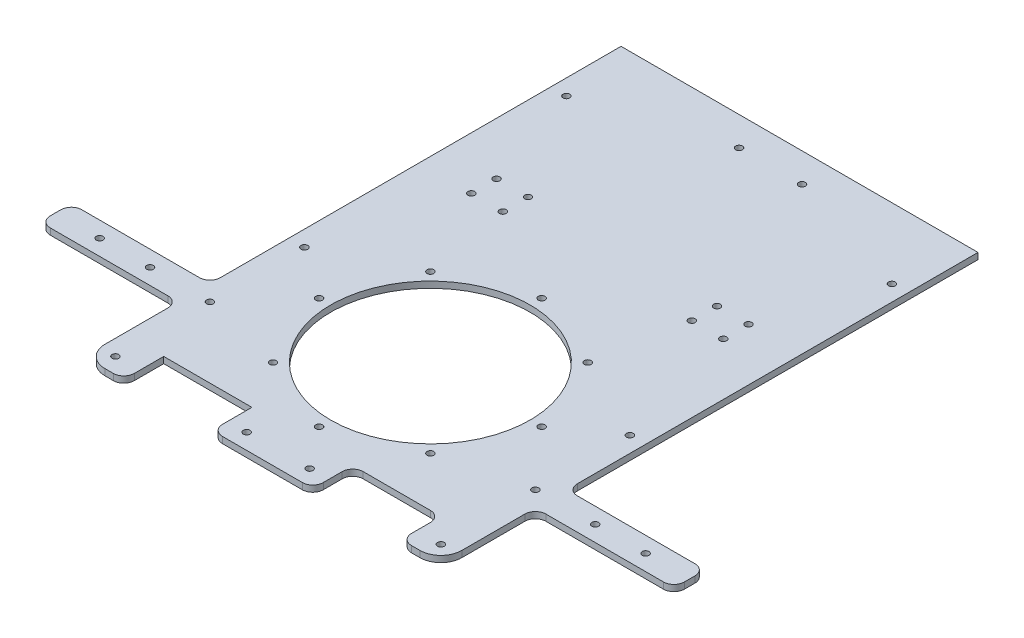
from build123d import *

# Parameters (mm, degrees)
BOSS_EXTRUDE1_DEPTH = 3
FILLET1_R           = 200
FILLET2_R           = 10
CUT_EXTRUDE2_DEPTH  = 429.345808882
SKETCH3_W           = 42
SKETCH3_H           = 23
SKETCH3_H_2         = 19
CUT_EXTRUDE3_DEPTH  = 429.345808882
SKETCH4_R           = 1.6
CUT_EXTRUDE5_DEPTH  = 429.345808882
SKETCH5_R           = 1.6
CUT_EXTRUDE6_DEPTH  = 429.345808882
SKETCH6_W           = 66
SKETCH6_H           = 15
SKETCH6_R           = 1.6
BOSS_EXTRUDE2_DEPTH = 3
FILLET3_R           = 5
SKETCH7_R           = 1.6
CUT_EXTRUDE7_DEPTH  = 435.224748243
SKETCH9_R           = 1.6
CUT_EXTRUDE8_DEPTH  = 435.224748243
SKETCH10_W          = 280
SKETCH10_H          = 108.680633212
CUT_EXTRUDE9_DEPTH  = 10


with BuildPart() as part:
    # Sketch1 → Boss-Extrude1 (new body)
    with BuildSketch(Plane(origin=(0, 0, 0), x_dir=(1, 0, 0), z_dir=(0, 1, 0))):
        Polygon((0, 0), (170, 0), (170, 300), (225, 300), (225, 367.51288694), (85, 330), (-55, 367.51288694), (-55, 300), (0, 300), align=None)
    extrude(amount=BOSS_EXTRUDE1_DEPTH)

    # Fillet1
    fillet1_edges = [part.edges().sort_by_distance(p)[0] for p in [
        (85, 1.5, -330),
    ]]
    fillet(fillet1_edges, radius=FILLET1_R)

    # Fillet2
    fillet2_edges = [part.edges().sort_by_distance(p)[0] for p in [
        (0, 1.5, -300),
        (-55, 1.5, -300),
        (-55, 1.5, -367.51288694),
        (225, 1.5, -367.51288694),
        (225, 1.5, -300),
        (170, 1.5, -300),
        (170, 1.5, 0),
        (0, 1.5, 0),
    ]]
    fillet(fillet2_edges, radius=FILLET2_R)

    # Sketch2 → Cut-Extrude2 (cut, through all)
    with BuildSketch(Plane(origin=(0, 3, 0), x_dir=(1, 0, 0), z_dir=(0, 1, 0))):
        with BuildLine():
            ThreePointArc((132.5, 80), (118.587572106, 113.587572106), (85, 127.5))
            Line((85, 127.5), (85, 32.5))
            ThreePointArc((85, 32.5), (118.587572106, 46.412427894), (132.5, 80))
        make_face()
        with BuildLine():
            Line((85, 32.5), (85, 127.5))
            ThreePointArc((85, 127.5), (37.5, 80), (85, 32.5))
        make_face()
    extrude(amount=-CUT_EXTRUDE2_DEPTH, mode=Mode.SUBTRACT)

    # Sketch3 → Cut-Extrude3 (cut, through all)
    with BuildSketch(Plane(origin=(0, 3, 0), x_dir=(1, 0, 0), z_dir=(0, 1, 0))):
        with Locations((40, 267.3)):
            Rectangle(SKETCH3_W, SKETCH3_H)
        with Locations((130, 267.3)):
            Rectangle(SKETCH3_W, SKETCH3_H)
        with Locations((40, 9.5)):
            Rectangle(SKETCH3_W, SKETCH3_H_2)
        with Locations((130, 9.5)):
            Rectangle(SKETCH3_W, SKETCH3_H_2)
    extrude(amount=-CUT_EXTRUDE3_DEPTH, mode=Mode.SUBTRACT)

    # Sketch4 → Cut-Extrude5 (cut, through all)
    with BuildSketch(Plane(origin=(0, 3, 0), x_dir=(1, 0, 0), z_dir=(0, 1, 0))):
        with Locations(Location((85, 133, 0), (0, 0, 270))):
            Circle(SKETCH4_R)
        with Locations(Location((122.476659403, 117.476659403, 0), (0, 0, 270))):
            Circle(SKETCH4_R)
        with Locations(Location((138, 80, 0), (0, 0, 270))):
            Circle(SKETCH4_R)
        with Locations(Location((122.476659403, 42.523340597, 0), (0, 0, 270))):
            Circle(SKETCH4_R)
        with Locations(Location((85, 27, 0), (0, 0, 270))):
            Circle(SKETCH4_R)
        with Locations(Location((47.523340597, 42.523340597, 0), (0, 0, 270))):
            Circle(SKETCH4_R)
        with Locations(Location((32, 80, 0), (0, 0, 270))):
            Circle(SKETCH4_R)
        with Locations(Location((47.523340597, 117.476659403, 0), (0, 0, 270))):
            Circle(SKETCH4_R)
    extrude(amount=-CUT_EXTRUDE5_DEPTH, mode=Mode.SUBTRACT)

    # Sketch5 → Cut-Extrude6 (cut, through all)
    with BuildSketch(Plane(origin=(0, 3, 0), x_dir=(1, 0, 0), z_dir=(0, 1, 0))):
        with Locations(Location((7.5, 312, 0), (0, 0, 270))):
            Circle(SKETCH5_R)
        with Locations(Location((7.5, 267.3, 0), (0, 0, 270))):
            Circle(SKETCH5_R)
        with Locations(Location((7.5, 222.3, 0), (0, 0, 270))):
            Circle(SKETCH5_R)
        with Locations(Location((7.5, 97.5, 0), (0, 0, 270))):
            Circle(SKETCH5_R)
        with Locations(Location((7.5, 7.5, 0), (0, 0, 270))):
            Circle(SKETCH5_R)
        with Locations(Location((7.5, 52.5, 0), (0, 0, 270))):
            Circle(SKETCH5_R)
        with Locations(Location((70, 7.5, 0), (0, 0, 270))):
            Circle(SKETCH5_R)
        with Locations(Location((100, 7.5, 0), (0, 0, 270))):
            Circle(SKETCH5_R)
        with Locations(Location((162.5, 7.5, 0), (0, 0, 270))):
            Circle(SKETCH5_R)
        with Locations(Location((162.5, 52.5, 0), (0, 0, 270))):
            Circle(SKETCH5_R)
        with Locations(Location((162.5, 97.5, 0), (0, 0, 270))):
            Circle(SKETCH5_R)
        with Locations(Location((162.5, 222.3, 0), (0, 0, 270))):
            Circle(SKETCH5_R)
        with Locations(Location((162.5, 267.3, 0), (0, 0, 270))):
            Circle(SKETCH5_R)
        with Locations(Location((162.5, 312, 0), (0, 0, 270))):
            Circle(SKETCH5_R)
        with Locations(Location((162.5, 342.75495241, 0), (0, 0, 270))):
            Circle(SKETCH5_R)
        with Locations(Location((109.337835254, 328.510193298, 0), (0, 0, 270))):
            Circle(SKETCH5_R)
        with Locations(Location((60.662164746, 328.510193298, 0), (0, 0, 270))):
            Circle(SKETCH5_R)
        with Locations(Location((7.5, 342.75495241, 0), (0, 0, 270))):
            Circle(SKETCH5_R)
        with Locations(Location((70, 267.5, 0), (0, 0, 270))):
            Circle(SKETCH5_R)
        with Locations(Location((100, 267.5, 0), (0, 0, 270))):
            Circle(SKETCH5_R)
    extrude(amount=-CUT_EXTRUDE6_DEPTH, mode=Mode.SUBTRACT)

    # Sketch6 → Boss-Extrude2 (add)
    # profile 1 of 2: a face of its own
    with BuildSketch(Plane.XZ):
        with Locations((-33, -52.5)):
            Rectangle(SKETCH6_W, SKETCH6_H)
        with Locations(Location((-45, -52.5, 0), (0, 0, 270))):
            Circle(SKETCH6_R, mode=Mode.SUBTRACT)
        with Locations(Location((-21, -52.5, 0), (0, 0, 270))):
            Circle(SKETCH6_R, mode=Mode.SUBTRACT)
    # profile 2 of 2: a face of its own
    with BuildSketch(Plane.XZ):
        with Locations((203, -52.5)):
            Rectangle(SKETCH6_W, SKETCH6_H)
        with Locations(Location((191, -52.5, 0), (0, 0, 270))):
            Circle(SKETCH6_R, mode=Mode.SUBTRACT)
        with Locations(Location((215, -52.5, 0), (0, 0, 270))):
            Circle(SKETCH6_R, mode=Mode.SUBTRACT)
    extrude(amount=-BOSS_EXTRUDE2_DEPTH)

    # Fillet3
    fillet3_edges = [part.edges().sort_by_distance(p)[0] for p in [
        (19, 1.5, 0),
        (61, 1.5, 0),
        (109, 1.5, 0),
        (109, 1.5, -19),
        (151, 1.5, -19),
        (151, 1.5, 0),
        (0, 1.5, -45),
        (0, 1.5, -60),
        (-66, 1.5, -60),
        (-66, 1.5, -45),
        (170, 1.5, -60),
        (170, 1.5, -45),
        (236, 1.5, -45),
        (236, 1.5, -60),
    ]]
    fillet(fillet3_edges, radius=FILLET3_R)

    # Sketch7 → Cut-Extrude7 (cut, through all)
    with BuildSketch(Plane(origin=(0, 3, 0), x_dir=(1, 0, 0), z_dir=(0, 1, 0))):
        with Locations(Location((130, 171.5, 0), (0, 0, 270))):
            Circle(SKETCH7_R)
        with Locations(Location((145, 171.5, 0), (0, 0, 270))):
            Circle(SKETCH7_R)
        with Locations(Location((145, 159.5, 0), (0, 0, 270))):
            Circle(SKETCH7_R)
        with Locations(Location((130, 159.5, 0), (0, 0, 270))):
            Circle(SKETCH7_R)
        with Locations(Location((25, 171.5, 0), (0, 0, 270))):
            Circle(SKETCH7_R)
        with Locations(Location((40, 171.5, 0), (0, 0, 270))):
            Circle(SKETCH7_R)
        with Locations(Location((40, 159.5, 0), (0, 0, 270))):
            Circle(SKETCH7_R)
        with Locations(Location((25, 159.5, 0), (0, 0, 270))):
            Circle(SKETCH7_R)
        with Locations(Location((70, 242, 0), (0, 0, 270))):
            Circle(SKETCH7_R)
        with Locations(Location((100, 242, 0), (0, 0, 270))):
            Circle(SKETCH7_R)
    extrude(amount=-CUT_EXTRUDE7_DEPTH, mode=Mode.SUBTRACT)

    # Sketch9 → Cut-Extrude8 (cut, through all)
    with BuildSketch(Plane(origin=(0, 3, 0), x_dir=(1, 0, 0), z_dir=(0, 1, 0))):
        with Locations(Location((-45, 307.5, 0), (0, 0, 270))):
            Circle(SKETCH9_R)
        with Locations(Location((-15, 307.5, 0), (0, 0, 270))):
            Circle(SKETCH9_R)
        with Locations(Location((-45, 327.5, 0), (0, 0, 270))):
            Circle(SKETCH9_R)
        with Locations(Location((-15, 327.5, 0), (0, 0, 270))):
            Circle(SKETCH9_R)
        with Locations(Location((185, 307.5, 0), (0, 0, 90))):
            Circle(SKETCH9_R)
        with Locations(Location((185, 327.5, 0), (0, 0, 90))):
            Circle(SKETCH9_R)
        with Locations(Location((215, 307.5, 0), (0, 0, 90))):
            Circle(SKETCH9_R)
        with Locations(Location((215, 327.5, 0), (0, 0, 90))):
            Circle(SKETCH9_R)
    extrude(amount=-CUT_EXTRUDE8_DEPTH, mode=Mode.SUBTRACT)

    # Sketch10 → Cut-Extrude9 (cut)
    with BuildSketch(Plane(origin=(0, 3, 0), x_dir=(1, 0, 0), z_dir=(0, 1, 0))):
        with Locations((85, 310.140316606)):
            Rectangle(SKETCH10_W, SKETCH10_H)
    extrude(amount=-CUT_EXTRUDE9_DEPTH, mode=Mode.SUBTRACT)


solid = part.part
